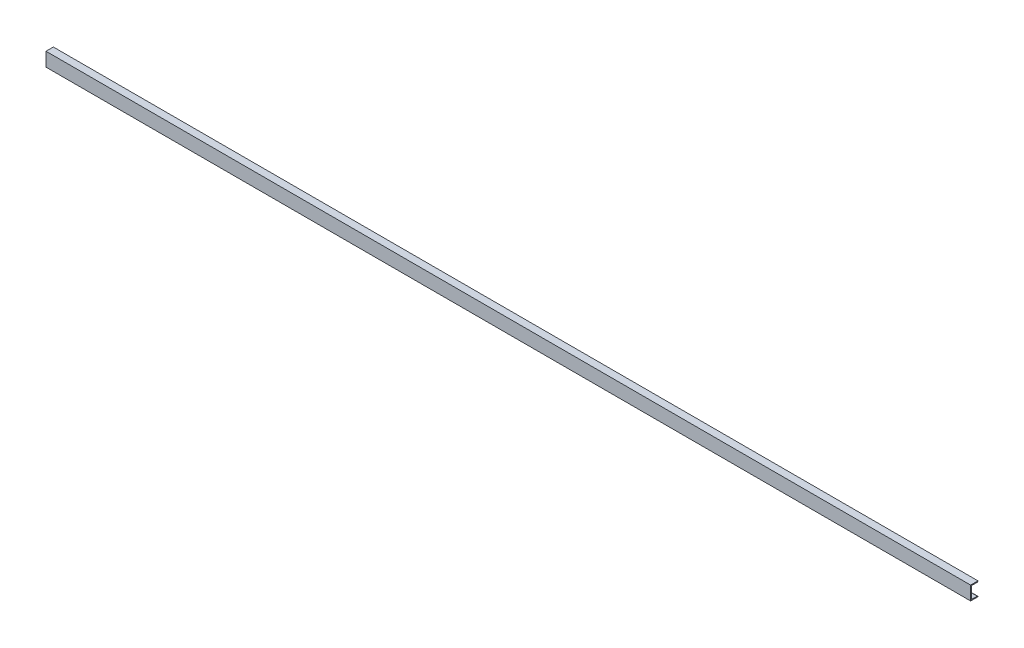
from build123d import *

# Parameters (mm, degrees)
BOSS_EXTRUDE1_DEPTH = 5030


with BuildPart() as part:
    # Sketch1 → Boss-Extrude1 (new body)
    with BuildSketch(Plane(origin=(0, 0, 0), x_dir=(0, 0, -1), z_dir=(1, 0, 0))):
        with BuildLine():
            Line((0, 0), (40, 0))
            ThreePointArc((40, 0), (38.535533906, 3.535533906), (35, 5))
            Line((35, 5), (5, 5))
            Line((5, 5), (5, 70))
            Line((5, 70), (35, 70))
            ThreePointArc((35, 70), (38.535533906, 71.464466094), (40, 75))
            Line((40, 75), (0, 75))
            Line((0, 75), (0, 0))
        make_face()
    extrude(amount=BOSS_EXTRUDE1_DEPTH)


solid = part.part
